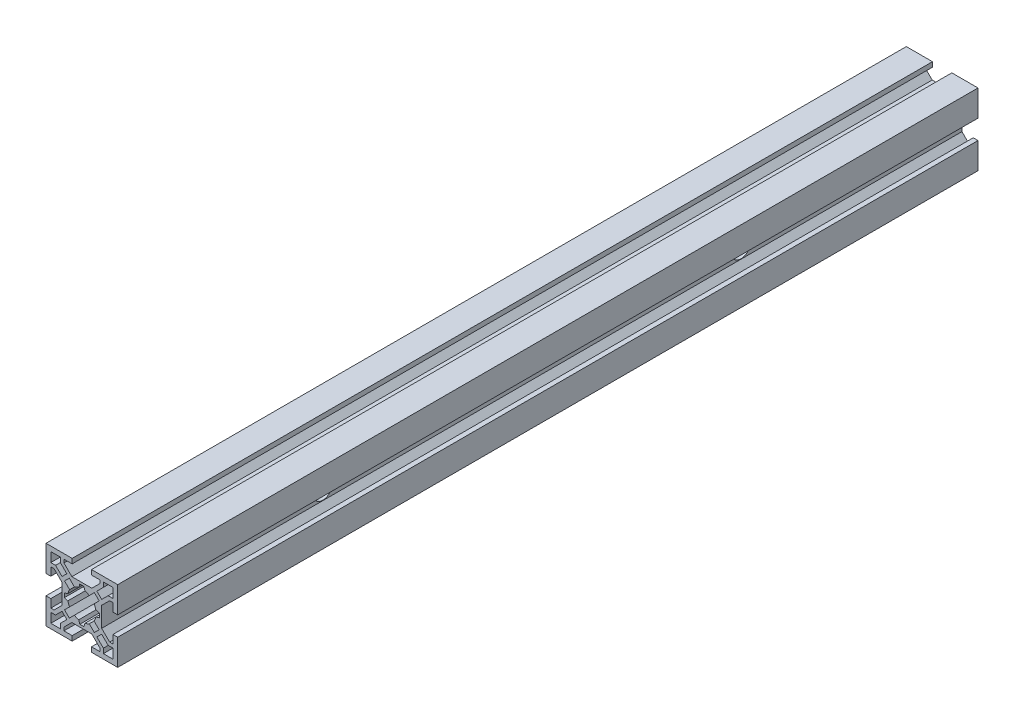
from build123d import *

# Parameters (mm, degrees)
RESSALTO_EXTRUS_O1_DEPTH   = 180
CORTE_EXTRUS_O1_DEPTH      = 182.245689604
CORTE_EXTRUS_O1_DEPTH_BACK = 182.245689604
ESBO_O2_R                  = 4


with BuildPart() as part:
    # Esboço1 → Ressalto-extrusão1 (new, symmetric)
    with BuildSketch(Plane.XY):
        Polygon((-13, -4.05), (-15, -4.05), (-15, -15), (-4.05, -15), (-4.05, -13), (-7.5, -13), (-7.5, -11.627272727), (-4.172727273, -8.3), (4.172727273, -8.3), (7.5, -11.627272727), (7.5, -13), (4.05, -13), (4.05, -15), (15, -15), (15, -4.05), (13, -4.05), (13, -7.5), (11.627272727, -7.5), (8.3, -4.172727273), (8.3, 4.172727273), (11.627272727, 7.5), (13, 7.5), (13, 4.05), (15, 4.05), (15, 15), (4.05, 15), (4.05, 13), (7.5, 13), (7.5, 11.627272727), (4.172727273, 8.3), (-4.172727273, 8.3), (-7.5, 11.627272727), (-7.5, 13), (-4.05, 13), (-4.05, 15), (-15, 15), (-15, 4.05), (-13, 4.05), (-13, 7.5), (-11.627272727, 7.5), (-8.3, 4.172727273), (-8.3, -4.172727273), (-11.627272727, -7.5), (-13, -7.5), align=None)
        with BuildLine():
            Line((-7.239339828, -5.233387445), (-5.125358847, -3.119406464))
            ThreePointArc((-5.125358847, -3.119406464), (-5.566897716, -2.238224702), (-5.858217272, -1.296645823))
            Line((-5.858217272, -1.296645823), (-7.3, -0.859788435))
            Line((-7.3, -0.859788435), (-7.3, 0.859788435))
            Line((-7.3, 0.859788435), (-5.858217272, 1.296645823))
            ThreePointArc((-5.858217272, 1.296645823), (-5.566897716, 2.238224702), (-5.125358847, 3.119406464))
            Line((-5.125358847, 3.119406464), (-7.239339828, 5.233387445))
            Line((-7.239339828, 5.233387445), (-5.233387445, 7.239339828))
            Line((-5.233387445, 7.239339828), (-3.119406464, 5.125358847))
            ThreePointArc((-3.119406464, 5.125358847), (-2.238224702, 5.566897716), (-1.296645823, 5.858217272))
            Line((-1.296645823, 5.858217272), (-0.859788435, 7.3))
            Line((-0.859788435, 7.3), (0.859788435, 7.3))
            Line((0.859788435, 7.3), (1.296645823, 5.858217272))
            ThreePointArc((1.296645823, 5.858217272), (2.238224702, 5.566897716), (3.119406464, 5.125358847))
            Line((3.119406464, 5.125358847), (5.233387445, 7.239339828))
            Line((5.233387445, 7.239339828), (7.239339828, 5.233387445))
            Line((7.239339828, 5.233387445), (5.125358847, 3.119406464))
            ThreePointArc((5.125358847, 3.119406464), (5.566897716, 2.238224702), (5.858217272, 1.296645823))
            Line((5.858217272, 1.296645823), (7.3, 0.859788435))
            Line((7.3, 0.859788435), (7.3, -0.859788435))
            Line((7.3, -0.859788435), (5.858217272, -1.296645823))
            ThreePointArc((5.858217272, -1.296645823), (5.566897716, -2.238224702), (5.125358847, -3.119406464))
            Line((5.125358847, -3.119406464), (7.239339828, -5.233387445))
            Line((7.239339828, -5.233387445), (5.233387445, -7.239339828))
            Line((5.233387445, -7.239339828), (3.119406464, -5.125358847))
            ThreePointArc((3.119406464, -5.125358847), (2.238224702, -5.566897716), (1.296645823, -5.858217272))
            Line((1.296645823, -5.858217272), (0.859788435, -7.3))
            Line((0.859788435, -7.3), (-0.859788435, -7.3))
            Line((-0.859788435, -7.3), (-1.296645823, -5.858217272))
            ThreePointArc((-1.296645823, -5.858217272), (-2.238224702, -5.566897716), (-3.119406464, -5.125358847))
            Line((-3.119406464, -5.125358847), (-5.233387445, -7.239339828))
            Line((-5.233387445, -7.239339828), (-7.239339828, -5.233387445))
        make_face(mode=Mode.SUBTRACT)
        Polygon((-11.005952384, -9), (-13, -9), (-13, -13), (-9, -13), (-9, -11.005952384), (-6.294047616, -8.3), (-8.3, -6.294047616), align=None, mode=Mode.SUBTRACT)
        Polygon((9, -11.005952384), (9, -13), (13, -13), (13, -9), (11.005952384, -9), (8.3, -6.294047616), (6.294047616, -8.3), align=None, mode=Mode.SUBTRACT)
        Polygon((11.005952384, 9), (13, 9), (13, 13), (9, 13), (9, 11.005952384), (6.294047616, 8.3), (8.3, 6.294047616), align=None, mode=Mode.SUBTRACT)
        Polygon((-9, 11.005952384), (-9, 13), (-13, 13), (-13, 9), (-11.005952384, 9), (-8.3, 6.294047616), (-6.294047616, 8.3), align=None, mode=Mode.SUBTRACT)
    extrude(amount=RESSALTO_EXTRUS_O1_DEPTH, both=True)

    # Esboço2 → Corte-extrusão1 (cut, two sides: drawn at the far end of the back side and taken through both)
    with BuildSketch(Plane(origin=(0, 0, 0), x_dir=(0, 0, -1), z_dir=(1, 0, 0)).offset(-CORTE_EXTRUS_O1_DEPTH_BACK)):
        with Locations(Location((87.5, 0, 0), (0, 0, 347.587575691))):
            Circle(ESBO_O2_R)
        with Locations(Location((-87.5, 0, 0), (0, 0, 347.587575691))):
            Circle(ESBO_O2_R)
    extrude(amount=CORTE_EXTRUS_O1_DEPTH + CORTE_EXTRUS_O1_DEPTH_BACK, mode=Mode.SUBTRACT)


solid = part.part
